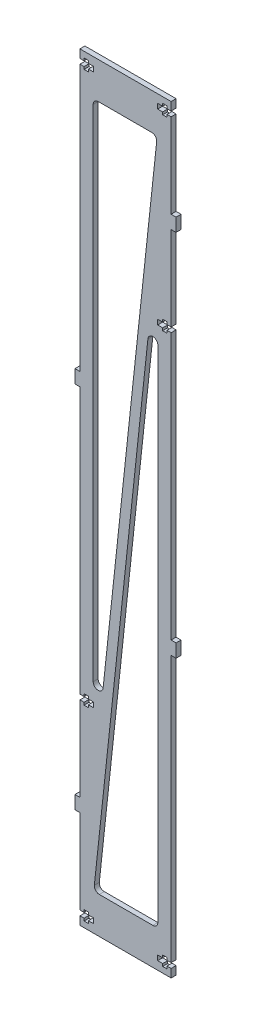
from build123d import *

# Parameters (mm, degrees)
EXTRUDE_1_DEPTH = 3


with BuildPart() as part:
    # 草图1 → 凸台-拉伸1 (new body)
    with BuildSketch(Plane.XY):
        Polygon((277.453360513, -198.037068397), (277.453360513, -203.037068397), (222.453360513, -203.037068397), (222.453360513, -198.037068397), (224.953360513, -198.037068397), (224.953360513, -199.537068397), (227.553360513, -199.537068397), (227.553360513, -198.037068397), (230.553360513, -198.037068397), (230.553360513, -195.037068397), (227.553360513, -195.037068397), (227.553360513, -193.537068397), (224.953360513, -193.537068397), (224.953360513, -195.037068397), (222.453360513, -195.037068397), (222.453360513, -144.126812717), (219.453360513, -144.126812717), (219.453360513, -140.126812717), (219.453360513, -136.126812717), (222.453360513, -136.126812717), (222.453360513, -85.216557036), (224.953360513, -85.216557036), (224.953360513, -86.716557036), (227.553360513, -86.716557036), (227.553360513, -85.216557036), (230.553360513, -85.216557036), (230.553360513, -82.216557036), (227.553360513, -82.216557036), (227.553360513, -80.716557036), (224.953360513, -80.716557036), (224.953360513, -82.216557036), (222.453360513, -82.216557036), (222.453360513, 78.373187283), (219.453360513, 78.373187283), (219.453360513, 82.373187283), (219.453360513, 86.373187283), (222.453360513, 86.373187283), (222.453360513, 246.962931603), (224.953360513, 246.962931603), (224.953360513, 245.462931603), (227.553360513, 245.462931603), (227.553360513, 246.962931603), (230.553360513, 246.962931603), (230.553360513, 249.962931603), (227.553360513, 249.962931603), (227.553360513, 251.462931603), (224.953360513, 251.462931603), (224.953360513, 249.962931603), (222.453360513, 249.962931603), (222.453360513, 254.962931603), (277.453360513, 254.962931603), (277.453360513, 249.962931603), (274.953360513, 249.962931603), (274.953360513, 251.462931603), (272.353360513, 251.462931603), (272.353360513, 249.962931603), (269.353360513, 249.962931603), (269.353360513, 246.962931603), (272.353360513, 246.962931603), (272.353360513, 245.462931603), (274.953360513, 245.462931603), (274.953360513, 246.962931603), (277.453360513, 246.962931603), (277.453360513, 196.052675922), (280.453360513, 196.052675922), (280.453360513, 192.052675922), (280.453360513, 188.052675922), (277.453360513, 188.052675922), (277.453360513, 137.142420241), (274.953360513, 137.142420241), (274.953360513, 138.642420241), (272.353360513, 138.642420241), (272.353360513, 137.142420241), (269.353360513, 137.142420241), (269.353360513, 134.142420241), (272.353360513, 134.142420241), (272.353360513, 132.642420241), (274.953360513, 132.642420241), (274.953360513, 134.142420241), (277.453360513, 134.142420241), (277.453360513, -26.447324078), (280.453360513, -26.447324078), (280.453360513, -30.447324078), (280.453360513, -34.447324078), (277.453360513, -34.447324078), (277.453360513, -195.037068397), (274.953360513, -195.037068397), (274.953360513, -193.537068397), (272.353360513, -193.537068397), (272.353360513, -195.037068397), (269.353360513, -195.037068397), (269.353360513, -198.037068397), (272.353360513, -198.037068397), (272.353360513, -199.537068397), (274.953360513, -199.537068397), (274.953360513, -198.037068397), align=None)
        with BuildLine():
            Line((233.453360513, 232.962931603), (265.776162867, 232.962931603))
            ThreePointArc((265.776162867, 232.962931603), (268.007619579, 231.968075224), (268.759090329, 229.643332232))
            Line((268.759090329, 229.643332232), (236.436287975, -72.036156407))
            ThreePointArc((236.436287975, -72.036156407), (233.293332993, -74.712285861), (230.453360513, -71.716557036))
            Line((230.453360513, -71.716557036), (230.453360513, 229.962931603))
            ThreePointArc((230.453360513, 229.962931603), (231.33204017, 232.084251946), (233.453360513, 232.962931603))
        make_face(mode=Mode.SUBTRACT)
        with BuildLine():
            Line((269.453360513, 123.642420241), (269.453360513, -178.037068397))
            ThreePointArc((269.453360513, -178.037068397), (268.574680857, -180.158388741), (266.453360513, -181.037068397))
            Line((266.453360513, -181.037068397), (234.130558159, -181.037068397))
            ThreePointArc((234.130558159, -181.037068397), (231.899101447, -180.042212019), (231.147630697, -177.717469026))
            Line((231.147630697, -177.717469026), (263.470433052, 123.962019612))
            ThreePointArc((263.470433052, 123.962019612), (266.613388034, 126.638149066), (269.453360513, 123.642420241))
        make_face(mode=Mode.SUBTRACT)
    extrude(amount=EXTRUDE_1_DEPTH)


solid = part.part
